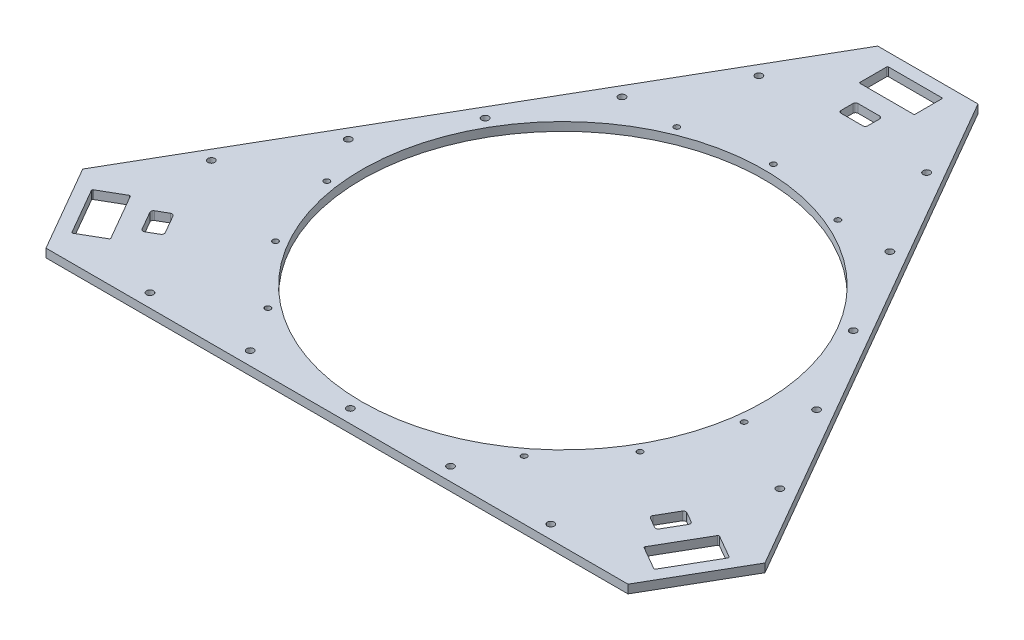
from build123d import *

# Parameters (mm, degrees)
SKETCH1_R             = 150.5
BOSS_EXTRUDE1_DEPTH   = 6.35
SKETCH3_R             = 2.6
CUT_EXTRUDE2_DEPTH    = 10
M5X0_8_TAPPED_HOLE1_D = 4.2
CUT_EXTRUDE3_DEPTH    = 10


with BuildPart() as part:
    # Sketch1 → Boss-Extrude1 (new body)
    with BuildSketch(Plane(origin=(-388.281715987, 0, -288.185661777), x_dir=(1, 0, 0), z_dir=(0, 1, 0))):
        Polygon((1747.570833697, -13084.824581071), (1672.514355591, -13084.824581071), (1454.703489965, -13462.084066777), (1492.231729019, -13527.084883536), (1927.853460271, -13527.084883536), (1965.381699324, -13462.084066777), align=None)
        with Locations(Location((1710.042594644, -13357.997843795, 0), (0, 0, 270))):
            Circle(SKETCH1_R, mode=Mode.SUBTRACT)
        with BuildLine():
            Line((1730.692592416, -13114.874577827), (1730.692592416, -13095.074579966))
            ThreePointArc((1730.692592416, -13095.074579966), (1730.472922526, -13094.544249938), (1729.942592497, -13094.324580043))
            Line((1729.942592497, -13094.324580043), (1690.142596792, -13094.324580043))
            ThreePointArc((1690.142596792, -13094.324580043), (1689.612266761, -13094.544249935), (1689.392596873, -13095.074579966))
            Line((1689.392596873, -13095.074579966), (1689.392596873, -13114.874577827))
            ThreePointArc((1689.392596873, -13114.874577827), (1689.612266763, -13115.404907856), (1690.142596792, -13115.62457775))
            Line((1690.142596792, -13115.62457775), (1729.942592497, -13115.62457775))
            ThreePointArc((1729.942592497, -13115.62457775), (1730.472922528, -13115.404907859), (1730.692592416, -13114.874577827))
        make_face(mode=Mode.SUBTRACT)
        with BuildLine():
            Line((1492.669367808, -13507.342898369), (1509.816668952, -13497.442899438))
            ThreePointArc((1509.816668952, -13497.442899438), (1510.166113284, -13496.987494718), (1510.091187977, -13496.418380495))
            Line((1510.091187977, -13496.418380495), (1490.191190123, -13461.950573141))
            ThreePointArc((1490.191190123, -13461.950573141), (1489.735785404, -13461.60112881), (1489.166671181, -13461.676054117))
            Line((1489.166671181, -13461.676054117), (1472.019370034, -13471.57605305))
            ThreePointArc((1472.019370034, -13471.57605305), (1471.669925699, -13472.031457773), (1471.744851013, -13472.600571998))
            Line((1471.744851013, -13472.600571998), (1491.644848864, -13507.068379347))
            ThreePointArc((1491.644848864, -13507.068379347), (1492.100253585, -13507.41782368), (1492.669367808, -13507.342898369))
        make_face(mode=Mode.SUBTRACT)
        with BuildLine():
            Line((1948.065819252, -13471.576053055), (1930.918518105, -13461.676054122))
            ThreePointArc((1930.918518105, -13461.676054122), (1930.349403886, -13461.601128813), (1929.893999164, -13461.95057314))
            Line((1929.893999164, -13461.95057314), (1909.99400131, -13496.418380494))
            ThreePointArc((1909.99400131, -13496.418380494), (1909.919076, -13496.98749472), (1910.268520339, -13497.442899434))
            Line((1910.268520339, -13497.442899434), (1927.415821483, -13507.342898365))
            ThreePointArc((1927.415821483, -13507.342898365), (1927.984935702, -13507.417823673), (1928.440340423, -13507.068379346))
            Line((1928.440340423, -13507.068379346), (1948.340338275, -13472.600571997))
            ThreePointArc((1948.340338275, -13472.600571997), (1948.415263583, -13472.031457775), (1948.065819252, -13471.576053055))
        make_face(mode=Mode.SUBTRACT)
    extrude(amount=BOSS_EXTRUDE1_DEPTH)

    # Sketch3 → Cut-Extrude2 (cut)
    with BuildSketch(Plane(origin=(0, 6.35, 0), x_dir=(1, 0, 0), z_dir=(0, 1, 0))):
        with Locations(Location((1183.987460829, -12990.268662147, 0), (0, 0, 270))):
            Circle(SKETCH3_R)
        with Locations(Location((1146.487460829, -13055.220567431, 0), (0, 0, 270))):
            Circle(SKETCH3_R)
        with Locations(Location((1108.987460829, -13120.172472715, 0), (0, 0, 270))):
            Circle(SKETCH3_R)
        with Locations(Location((1221.487460829, -12925.316756863, 0), (0, 0, 270))):
            Circle(SKETCH3_R)
        with Locations(Location((1258.987460829, -12860.364851579, 0), (0, 0, 270))):
            Circle(SKETCH3_R)
        with Locations(Location((1459.534296487, -12990.268662148, 0), (0, 0, 270))):
            Circle(SKETCH3_R)
        with Locations(Location((1497.034296487, -13055.220567432, 0), (0, 0, 270))):
            Circle(SKETCH3_R)
        with Locations(Location((1534.534296487, -13120.172472716, 0), (0, 0, 270))):
            Circle(SKETCH3_R)
        with Locations(Location((1422.034296487, -12925.316756864, 0), (0, 0, 270))):
            Circle(SKETCH3_R)
        with Locations(Location((1384.534296487, -12860.364851581, 0), (0, 0, 270))):
            Circle(SKETCH3_R)
        with Locations(Location((1321.760878657, -13228.899221759, 0), (0, 0, 270))):
            Circle(SKETCH3_R)
        with Locations(Location((1246.760878657, -13228.899221759, 0), (0, 0, 270))):
            Circle(SKETCH3_R)
        with Locations(Location((1171.760878657, -13228.899221759, 0), (0, 0, 270))):
            Circle(SKETCH3_R)
        with Locations(Location((1396.760878657, -13228.899221759, 0), (0, 0, 270))):
            Circle(SKETCH3_R)
        with Locations(Location((1471.760878657, -13228.899221759, 0), (0, 0, 270))):
            Circle(SKETCH3_R)
    extrude(amount=-CUT_EXTRUDE2_DEPTH, mode=Mode.SUBTRACT)

    # M5x0.8 Tapped Hole1 (through all)
    with Locations(Plane(origin=(0, 6.35, 0), x_dir=(1, 0, 0), z_dir=(0, 1, 0))):
        with Locations((1321.760878658, -12912.312182018), (1321.760878658, -13069.812182018), (1382.033519255, -12924.301155648), (1261.48823806, -12924.301155648), (1185.361877562, -13148.562182018), (1165.608312991, -13090.370057293), (1225.880953589, -13194.765333114), (1417.640803726, -13194.765333114), (1458.159879754, -13148.562182018), (1477.913444324, -13090.370057293)):
            Hole(M5X0_8_TAPPED_HOLE1_D / 2)

    # Sketch9 → Cut-Extrude3 (cut)
    with BuildSketch(Plane(origin=(0, 6.35, 0), x_dir=(1, 0, 0), z_dir=(0, 1, 0))):
        with BuildLine():
            Line((1522.758854804, -13174.820007204), (1515.224433791, -13170.470007204))
            ThreePointArc((1515.224433791, -13170.470007204), (1513.706795701, -13170.270206359), (1512.492382983, -13171.202058012))
            Line((1512.492382983, -13171.202058012), (1504.492382983, -13185.058464472))
            ThreePointArc((1504.492382983, -13185.058464472), (1504.292582138, -13186.576102563), (1505.224433791, -13187.79051528))
            Line((1505.224433791, -13187.79051528), (1512.758854804, -13192.14051528))
            ThreePointArc((1512.758854804, -13192.14051528), (1514.276492894, -13192.340316125), (1515.490905611, -13191.408464472))
            Line((1515.490905611, -13191.408464472), (1523.490905611, -13177.552058012))
            ThreePointArc((1523.490905611, -13177.552058012), (1523.690706456, -13176.034419922), (1522.758854804, -13174.820007204))
        make_face()
        with BuildLine():
            Line((1312.201334792, -12843.238915973), (1312.201334792, -12851.938915973))
            ThreePointArc((1312.201334792, -12851.938915973), (1312.787121229, -12853.353129536), (1314.201334792, -12853.938915973))
            Line((1314.201334792, -12853.938915973), (1330.201334792, -12853.938915973))
            ThreePointArc((1330.201334792, -12853.938915973), (1331.615548354, -12853.353129536), (1332.201334792, -12851.938915973))
            Line((1332.201334792, -12851.938915973), (1332.201334792, -12843.238915973))
            ThreePointArc((1332.201334792, -12843.238915973), (1331.615548354, -12841.824702411), (1330.201334792, -12841.238915973))
            Line((1330.201334792, -12841.238915973), (1314.201334792, -12841.238915973))
            ThreePointArc((1314.201334792, -12841.238915973), (1312.787121229, -12841.824702411), (1312.201334792, -12843.238915973))
        make_face()
        with BuildLine():
            Line((1130.322446377, -13191.377622877), (1137.85686739, -13187.027622877))
            ThreePointArc((1137.85686739, -13187.027622877), (1138.788719043, -13185.81321016), (1138.588918198, -13184.29557207))
            Line((1138.588918198, -13184.29557207), (1130.588918198, -13170.439165609))
            ThreePointArc((1130.588918198, -13170.439165609), (1129.37450548, -13169.507313956), (1127.85686739, -13169.707114801))
            Line((1127.85686739, -13169.707114801), (1120.322446377, -13174.057114801))
            ThreePointArc((1120.322446377, -13174.057114801), (1119.390594725, -13175.271527519), (1119.59039557, -13176.789165609))
            Line((1119.59039557, -13176.789165609), (1127.59039557, -13190.64557207))
            ThreePointArc((1127.59039557, -13190.64557207), (1128.804808287, -13191.577423722), (1130.322446377, -13191.377622877))
        make_face()
    extrude(amount=-CUT_EXTRUDE3_DEPTH, mode=Mode.SUBTRACT)


solid = part.part
